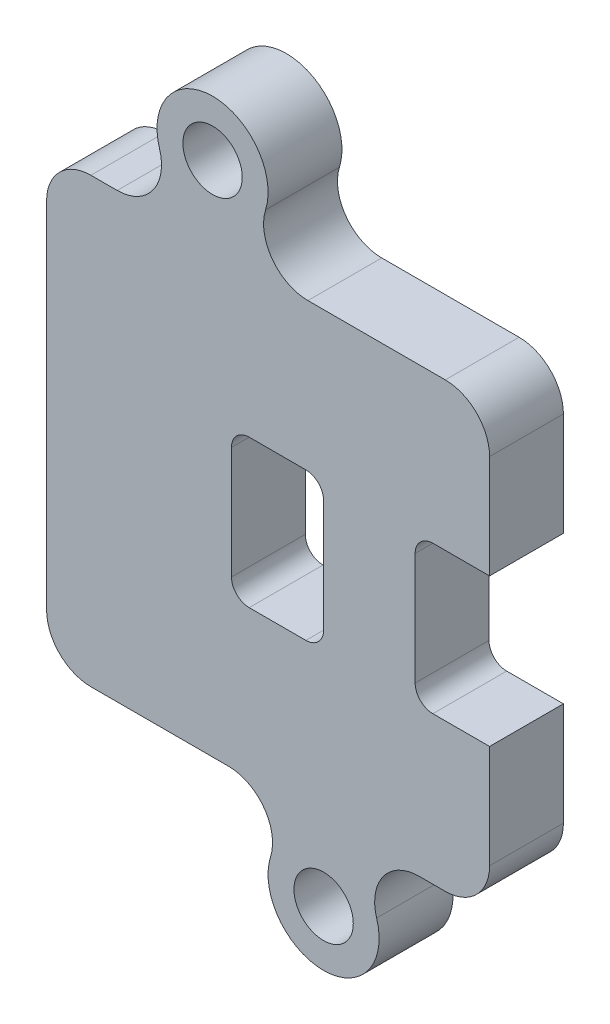
from build123d import *

# Parameters (mm, degrees)
SKETCH1_R           = 2.5527
BOSS_EXTRUDE1_DEPTH = 6.35


with BuildPart() as part:
    # Sketch1 → Boss-Extrude1 (new body)
    with BuildSketch(Plane.XY):
        with BuildLine():
            Line((-17.751257214, 44.45), (-20.0152, 44.45))
            ThreePointArc((-20.0152, 44.45), (-22.709276836, 43.334076836), (-23.8252, 40.64))
            Line((-23.8252, 40.64), (-23.8252, 10.16))
            ThreePointArc((-23.8252, 10.16), (-22.709276836, 7.465923164), (-20.0152, 6.35))
            Line((-20.0152, 6.35), (-8.200857214, 6.35))
            ThreePointArc((-8.200857214, 6.35), (-5.134034416, 4.800685279), (-4.561423539, 1.412781065))
            ThreePointArc((-4.561423539, 1.412781065), (0, -4.7752), (4.561423539, 1.412781065))
            ThreePointArc((4.561423539, 1.412781065), (5.134034416, 4.800685279), (8.200857214, 6.35))
            Line((8.200857214, 6.35), (10.4648, 6.35))
            ThreePointArc((10.4648, 6.35), (13.158876836, 7.465923164), (14.2748, 10.16))
            Line((14.2748, 10.16), (14.2748, 19.05))
            Line((14.2748, 19.05), (9.398, 19.05))
            ThreePointArc((9.398, 19.05), (8.320369265, 19.496369265), (7.874, 20.574))
            Line((7.874, 20.574), (7.874, 30.226))
            ThreePointArc((7.874, 30.226), (8.320369265, 31.303630735), (9.398, 31.75))
            Line((9.398, 31.75), (14.2748, 31.75))
            Line((14.2748, 31.75), (14.2748, 40.64))
            ThreePointArc((14.2748, 40.64), (13.158876836, 43.334076836), (10.4648, 44.45))
            Line((10.4648, 44.45), (-1.349542786, 44.45))
            ThreePointArc((-1.349542786, 44.45), (-4.416365584, 45.999314721), (-4.988976461, 49.387218935))
            ThreePointArc((-4.988976461, 49.387218935), (-9.5504, 55.5752), (-14.111823539, 49.387218935))
            ThreePointArc((-14.111823539, 49.387218935), (-14.684434416, 45.999314721), (-17.751257214, 44.45))
        make_face()
        Circle(SKETCH1_R, mode=Mode.SUBTRACT)
        with Locations((-9.5504, 50.8)):
            Circle(SKETCH1_R, mode=Mode.SUBTRACT)
        with BuildLine():
            ThreePointArc((-7.9248, 30.226), (-7.478430735, 31.303630735), (-6.4008, 31.75))
            Line((-6.4008, 31.75), (-1.524, 31.75))
            ThreePointArc((-1.524, 31.75), (-0.446369265, 31.303630735), (0, 30.226))
            Line((0, 30.226), (0, 20.574))
            ThreePointArc((0, 20.574), (-0.446369265, 19.496369265), (-1.524, 19.05))
            Line((-1.524, 19.05), (-6.4008, 19.05))
            ThreePointArc((-6.4008, 19.05), (-7.478430735, 19.496369265), (-7.9248, 20.574))
            Line((-7.9248, 20.574), (-7.9248, 30.226))
        make_face(mode=Mode.SUBTRACT)
    extrude(amount=BOSS_EXTRUDE1_DEPTH)


solid = part.part
